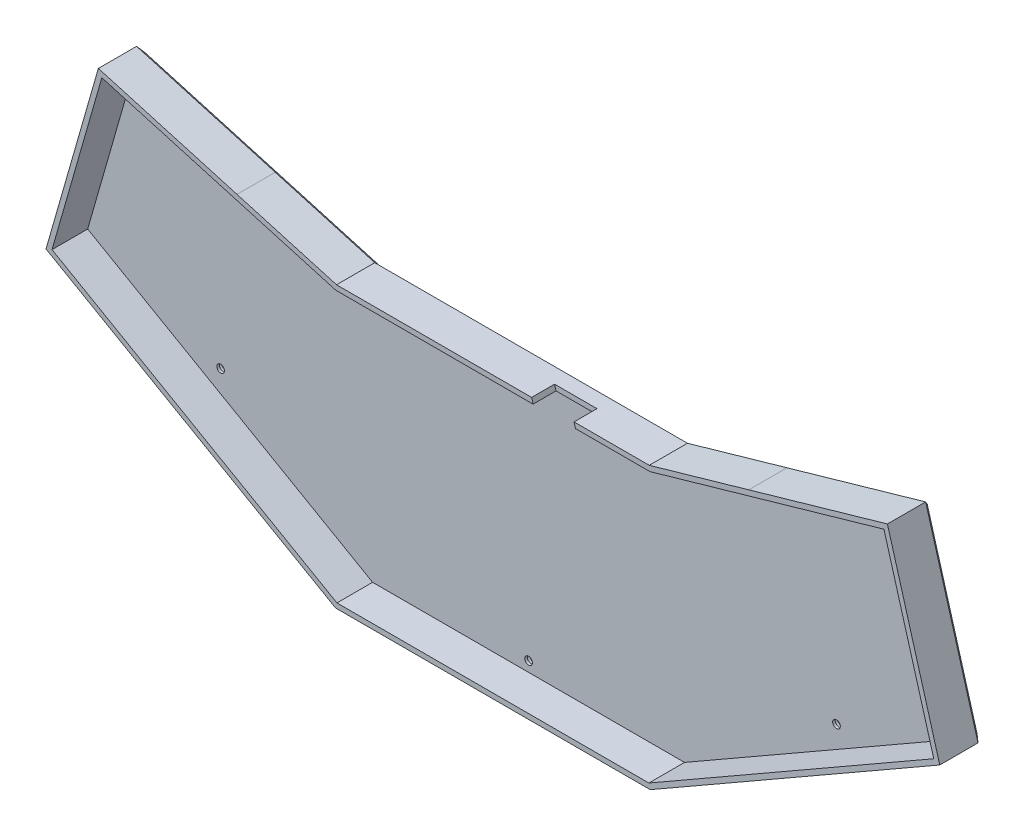
from build123d import *

# Parameters (mm, degrees)
BOSS_EXTRU_1_DEPTH      = 14
BOSS_EXTRU_2_DEPTH      = 3
ENL_V_START             = 5
ENL_V_MAT_EXTRU_1_DEPTH = 10
ESQUISSE7_R             = 1.5
ENL_V_MAT_EXTRU_2_DEPTH = 10
ESQUISSE8_R             = 3
ENL_V_MAT_EXTRU_3_DEPTH = 2
CHANFREIN1_SIZE         = 2


with BuildPart() as part:
    # Esquisse1 → Boss.-Extru.1 (new body)
    with BuildSketch(Plane.XY):
        Polygon((229.15721289, -14.84723942), (106.433306853, -14.84723942), (67.372523259, -3.649091023), (12.961214213, 11.953100779), (-7.58450021, -59.698320459), (106.05278448, -124.898736851), (229.537735263, -124.898736851), (343.175019953, -59.698320459), (322.62930553, 11.953100779), (268.217996484, -3.649091023), align=None)
        Polygon((229.438237844, -16.84723942), (106.152281899, -16.84723942), (66.821302011, -5.571629745), (14.332462893, 9.479302675), (-5.230075099, -58.743374877), (106.585792597, -122.898736851), (229.004727146, -122.898736851), (340.820594842, -58.743374877), (321.25805685, 9.479302675), (268.769217732, -5.571629745), align=None, mode=Mode.SUBTRACT)
    extrude(amount=BOSS_EXTRU_1_DEPTH)

    # Esquisse2 → Boss.-Extru.2 (add)
    with BuildSketch(Plane(origin=(0, 0, 0), x_dir=(-1, 0, 0), z_dir=(0, 0, -1))):
        Polygon((-229.15721289, -14.84723942), (-268.217996484, -3.649091023), (-322.62930553, 11.953100779), (-343.175019953, -59.698320459), (-229.537735263, -124.898736851), (-106.05278448, -124.898736851), (7.58450021, -59.698320459), (-12.961214213, 11.953100779), (-67.372523259, -3.649091023), (-106.433306853, -14.84723942), align=None)
    extrude(amount=BOSS_EXTRU_2_DEPTH)

    # Esquisse3 → Enlèv. mat.-Extru.1 (cut)
    with BuildSketch(Plane.XY.offset(ENL_V_START)):
        Polygon((193.384025698, 6.988548589), (218.304917235, -79.922959834), (202.924702789, -84.333062282), (178.003811253, 2.578446141), align=None)
    extrude(amount=ENL_V_MAT_EXTRU_1_DEPTH, mode=Mode.SUBTRACT)

    # Esquisse7 → Enlèv. mat.-Extru.2 (cut)
    with BuildSketch(Plane.XY):
        with Locations((312.747989314, 2.877882334)):
            Circle(ESQUISSE7_R)
        with Locations((167.795259872, -20.84723942)):
            Circle(ESQUISSE7_R)
        with Locations(Location((22.842530429, 2.877882334, 0), (0, 0, 180))):
            Circle(ESQUISSE7_R)
        with Locations(Location((167.795259872, -118.898736851, 0), (0, 0, 180))):
            Circle(ESQUISSE7_R)
        with Locations((46.946880967, -80.077290604)):
            Circle(ESQUISSE7_R)
        with Locations(Location((288.643638776, -80.077290604, 0), (0, 0, 180))):
            Circle(ESQUISSE7_R)
    extrude(amount=-ENL_V_MAT_EXTRU_2_DEPTH, mode=Mode.SUBTRACT)

    # Esquisse8 → Enlèv. mat.-Extru.3 (cut)
    with BuildSketch(Plane(origin=(0, 0, -3), x_dir=(-1, 0, 0), z_dir=(0, 0, -1))):
        with Locations((-22.842530429, 2.877882334)):
            Circle(ESQUISSE8_R)
        with Locations((-46.946880967, -80.077290604)):
            Circle(ESQUISSE8_R)
        with Locations((-167.795259872, -118.898736851)):
            Circle(ESQUISSE8_R)
        with Locations((-167.795259872, -20.84723942)):
            Circle(ESQUISSE8_R)
        with Locations((-288.643638776, -80.077290604)):
            Circle(ESQUISSE8_R)
        with Locations((-312.747989314, 2.877882334)):
            Circle(ESQUISSE8_R)
    extrude(amount=-ENL_V_MAT_EXTRU_3_DEPTH, mode=Mode.SUBTRACT)

    # Chanfrein1
    chanfrein1_edges = [part.edges().sort_by_distance(p)[0] for p in [
        (167.795259872, -14.84723942, -3),
        (248.687604687, -9.248165222, -3),
        (295.423651007, 4.152004878, -3),
        (332.902162742, -23.87260984, -3),
        (286.356377608, -92.298528655, -3),
        (167.795259872, -124.898736851, -3),
        (49.234142135, -92.298528655, -3),
        (2.688357001, -23.87260984, -3),
        (40.166868736, 4.152004878, -3),
        (86.902915056, -9.248165222, -3),
    ]]
    chamfer(chanfrein1_edges, length=CHANFREIN1_SIZE)


solid = part.part
